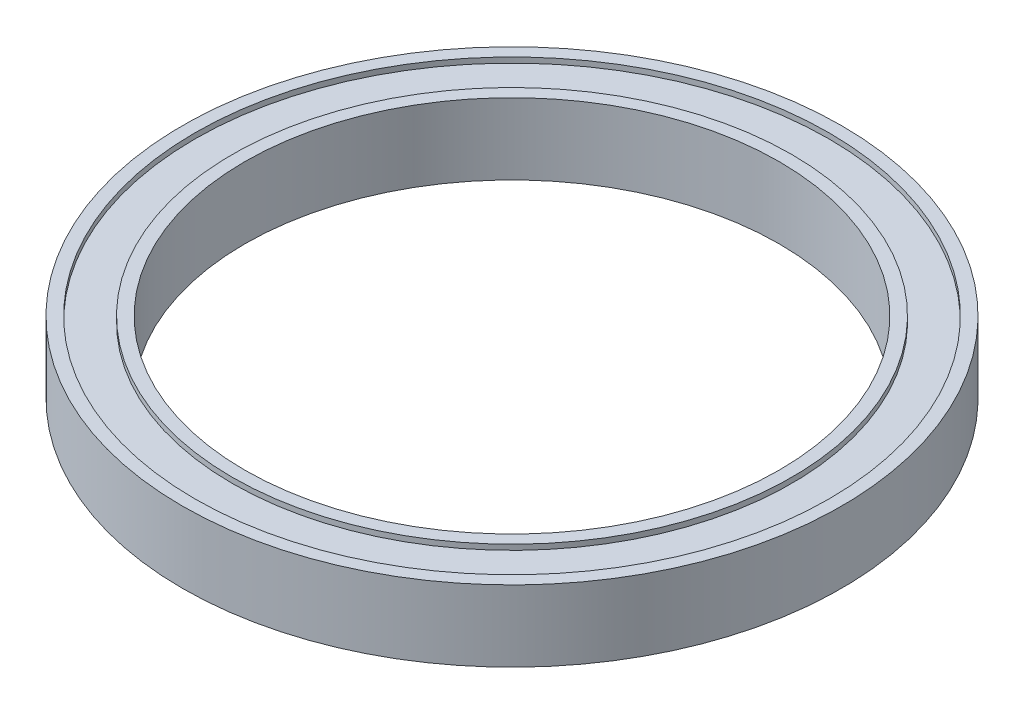
from build123d import *

# Parameters (mm, degrees)
SKETCH_1_R          = 18.5
SKETCH_1_R_2        = 15
EXTRUDE_1_DEPTH     = 4
SKETCH_2_R          = 17.8
SKETCH_2_R_2        = 15.7
CUT_EXTRUDE_1_DEPTH = 0.3


with BuildPart() as part:
    # 草图1 → 凸台-拉伸1 (new body)
    with BuildSketch(Plane(origin=(0, 0, 0), x_dir=(1, 0, 0), z_dir=(0, 1, 0))):
        with Locations(Location((0, 0, 0), (0, 0, 270))):
            Circle(SKETCH_1_R)
        with Locations(Location((0, 0, 0), (0, 0, 270))):
            Circle(SKETCH_1_R_2, mode=Mode.SUBTRACT)
    extrude(amount=EXTRUDE_1_DEPTH)

    # 草图2 → 切除-拉伸1 (cut)
    with BuildSketch(Plane(origin=(0, 4, 0), x_dir=(1, 0, 0), z_dir=(0, 1, 0))):
        with Locations(Location((0, 0, 0), (0, 0, 270))):
            Circle(SKETCH_2_R)
        with Locations(Location((0, 0, 0), (0, 0, 270))):
            Circle(SKETCH_2_R_2, mode=Mode.SUBTRACT)
    cut_extrude_1 = extrude(amount=-CUT_EXTRUDE_1_DEPTH, mode=Mode.SUBTRACT)

    # 镜向1: 切除-拉伸1 across plane
    add(cut_extrude_1.mirror(Plane.ZX.offset(2)), mode=Mode.SUBTRACT)


solid = part.part
